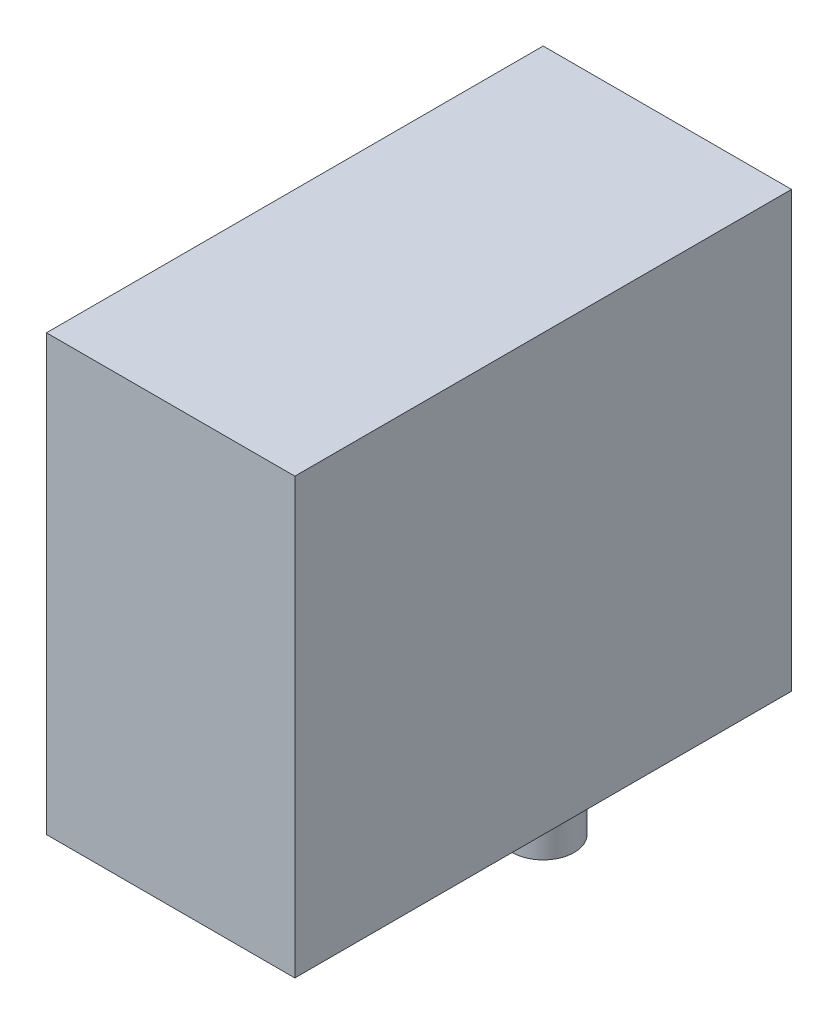
from build123d import *

# Parameters (mm, degrees)
SKETCH1_R           = 2.5
BOSS_EXTRUDE1_DEPTH = 10
SKETCH3_W           = 20
SKETCH3_H           = 40
BOSS_EXTRUDE2_DEPTH = 35


with BuildPart() as part:
    # Sketch1 → Boss-Extrude1 (new body)
    with BuildSketch(Plane(origin=(0, 0, 0), x_dir=(1, 0, 0), z_dir=(0, 1, 0))):
        Circle(SKETCH1_R)
    extrude(amount=BOSS_EXTRUDE1_DEPTH)

    # Sketch3 → Boss-Extrude2 (add)
    with BuildSketch(Plane(origin=(0, 10, 0), x_dir=(1, 0, 0), z_dir=(0, 1, 0))):
        with Locations((0, -10)):
            Rectangle(SKETCH3_W, SKETCH3_H)
    extrude(amount=BOSS_EXTRUDE2_DEPTH)


solid = part.part
